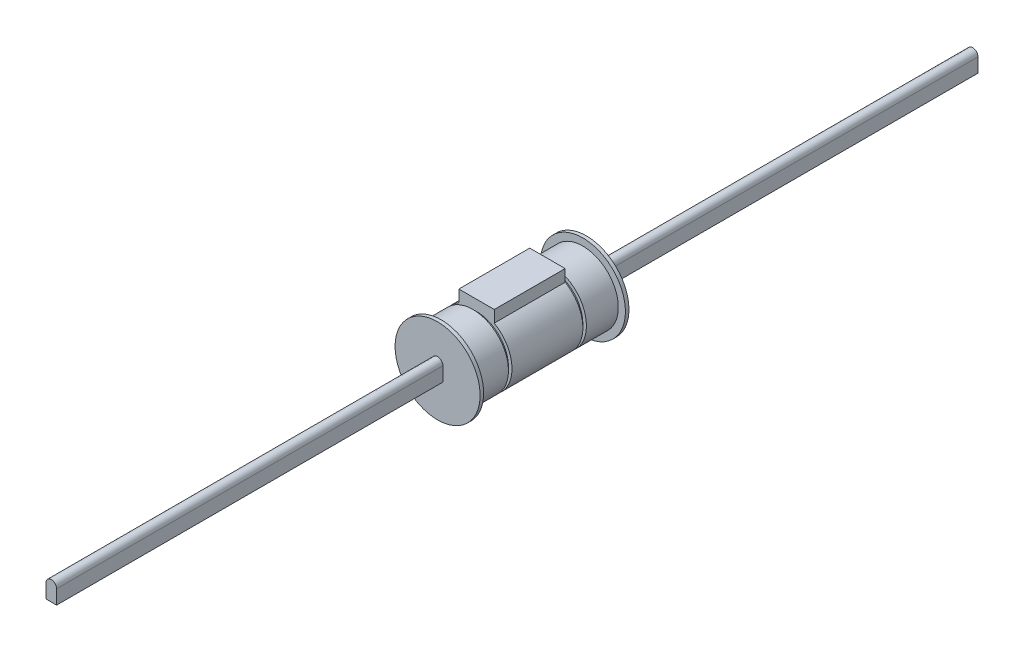
from build123d import *

# Parameters (mm, degrees)
BOSS_EXTRUDE4_DEPTH = 55
SKETCH4_R           = 5
BOSS_EXTRUDE5_DEPTH = 5
BOSS_EXTRUDE6_DEPTH = 10
SKETCH6_R           = 5
BOSS_EXTRUDE7_DEPTH = 5
BOSS_EXTRUDE8_DEPTH = 55
CUT_EXTRUDE2_START  = -0.5
SKETCH8_R           = 5
SKETCH8_R_2         = 4.5
CUT_EXTRUDE2_DEPTH  = 0.5
SKETCH9_R           = 6
BOSS_EXTRUDE9_DEPTH = 0.5


with BuildPart() as part:
    # Sketch1 → Boss-Extrude4 (new body)
    with BuildSketch(Plane.XY):
        with BuildLine():
            ThreePointArc((-0.75, 1), (0, 0.25), (0.75, 1))
            Line((0.75, 1), (-0.75, 1))
        make_face()
        with BuildLine():
            Line((-0.75, 1), (0.75, 1))
            ThreePointArc((0.75, 1), (0, 1.75), (-0.75, 1))
        make_face()
        with BuildLine():
            Line((-0.75, -1), (0.75, -1))
            Line((0.75, -1), (0.75, 1))
            ThreePointArc((0.75, 1), (0, 0.25), (-0.75, 1))
            Line((-0.75, 1), (-0.75, -1))
        make_face()
    extrude(amount=BOSS_EXTRUDE4_DEPTH)

    # Sketch4 → Boss-Extrude5 (add)
    with BuildSketch(Plane.XY.offset(55)):
        Circle(SKETCH4_R)
    extrude(amount=BOSS_EXTRUDE5_DEPTH)

    # Sketch5 → Boss-Extrude6 (add)
    with BuildSketch(Plane.XY.offset(60)):
        with BuildLine():
            Line((2.5, 4.330127019), (2.5, 4))
            Line((2.5, 4), (-2.5, 4))
            Line((-2.5, 4), (-2.5, 4.330127019))
            ThreePointArc((-2.5, 4.330127019), (-2.5, -4.330127019), (5, 0))
            ThreePointArc((5, 0), (4.330127019, 2.5), (2.5, 4.330127019))
        make_face()
        with BuildLine():
            Line((-2.5, 4), (2.5, 4))
            Line((2.5, 4), (2.5, 4.330127019))
            ThreePointArc((2.5, 4.330127019), (0, 5), (-2.5, 4.330127019))
            Line((-2.5, 4.330127019), (-2.5, 4))
        make_face()
        with BuildLine():
            ThreePointArc((-2.5, 4.330127019), (0, 5), (2.5, 4.330127019))
            Line((2.5, 4.330127019), (2.5, 6))
            Line((2.5, 6), (-2.5, 6))
            Line((-2.5, 6), (-2.5, 4.330127019))
        make_face()
    extrude(amount=BOSS_EXTRUDE6_DEPTH)

    # Sketch6 → Boss-Extrude7 (add)
    with BuildSketch(Plane.XY.offset(70)):
        Circle(SKETCH6_R)
    extrude(amount=BOSS_EXTRUDE7_DEPTH)

    # Sketch7 → Boss-Extrude8 (add)
    with BuildSketch(Plane.XY.offset(75)):
        with BuildLine():
            ThreePointArc((-0.75, 1), (0, 0.25), (0.75, 1))
            Line((0.75, 1), (-0.75, 1))
        make_face()
        with BuildLine():
            Line((-0.75, 1), (0.75, 1))
            ThreePointArc((0.75, 1), (0, 1.75), (-0.75, 1))
        make_face()
        with BuildLine():
            Line((-0.75, -1), (0.75, -1))
            Line((0.75, -1), (0.75, 1))
            ThreePointArc((0.75, 1), (0, 0.25), (-0.75, 1))
            Line((-0.75, 1), (-0.75, -1))
        make_face()
    extrude(amount=BOSS_EXTRUDE8_DEPTH)

    # Sketch8 → Cut-Extrude2 (cut)
    with BuildSketch(Plane.XY.offset(60).offset(CUT_EXTRUDE2_START)):
        Circle(SKETCH8_R)
        Circle(SKETCH8_R_2, mode=Mode.SUBTRACT)
    cut_extrude2 = extrude(amount=CUT_EXTRUDE2_DEPTH, mode=Mode.SUBTRACT)

    # Mirror3: Cut-Extrude2 across plane
    add(cut_extrude2.mirror(Plane.XY.offset(65)), mode=Mode.SUBTRACT)

    # Sketch9 → Boss-Extrude9 (add)
    with BuildSketch(Plane(origin=(0, 0, 55), x_dir=(-1, 0, 0), z_dir=(0, 0, -1))):
        Circle(SKETCH9_R)
    boss_extrude9 = extrude(amount=BOSS_EXTRUDE9_DEPTH)

    # Mirror4: Boss-Extrude9 across plane
    add(boss_extrude9.mirror(Plane.XY.offset(65)))


solid = part.part
